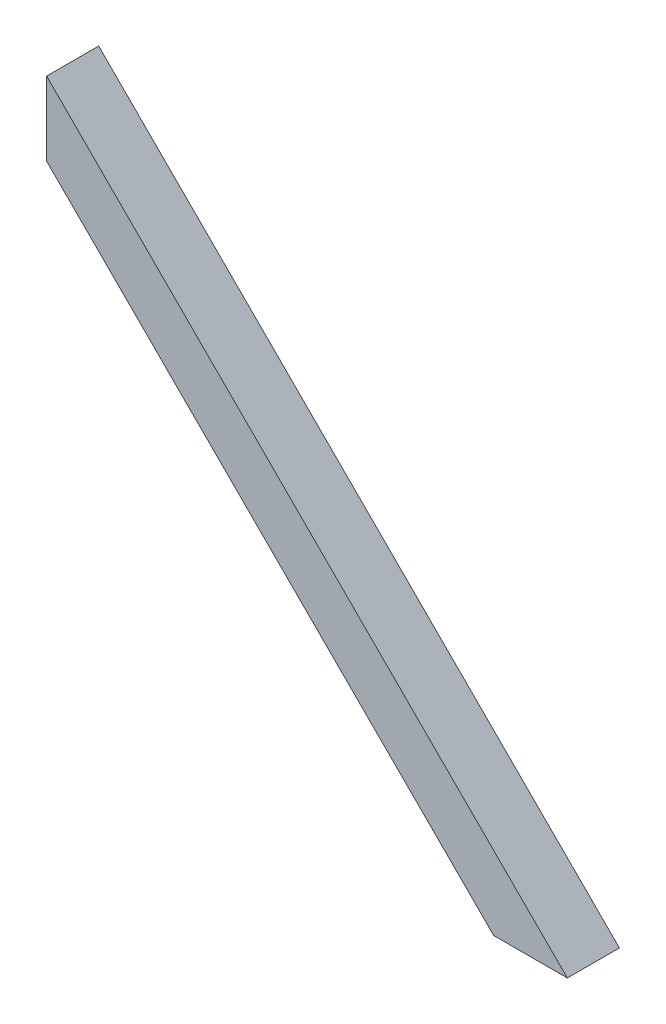
from build123d import *

# Parameters (mm, degrees)
EXTRUDE_1_DEPTH = 30


with BuildPart() as part:
    # 草图1 → 凸台-拉伸1 (new body)
    with BuildSketch(Plane.XY):
        Polygon((300, 0), (0, 300), (0, 257.573593129), (257.573593129, 0), align=None)
    extrude(amount=EXTRUDE_1_DEPTH)


solid = part.part
